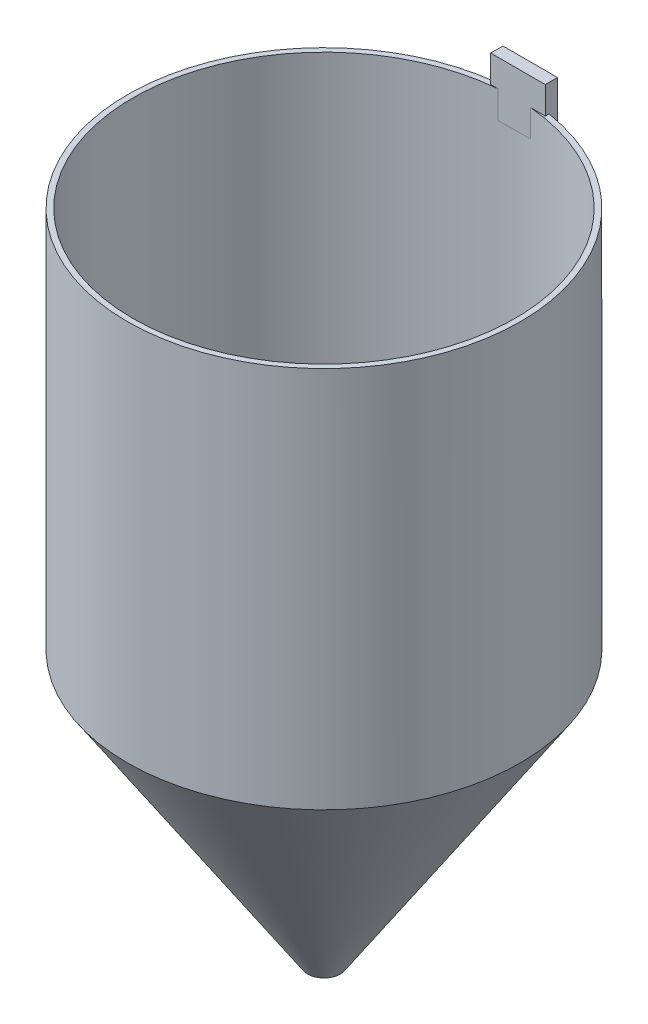
from build123d import *

# Parameters (mm, degrees)
SKETCH2_R           = 2
SKETCH2_R_2         = 5
CUT_EXTRUDE1_DEPTH  = 3
SKETCH3_W           = 10
SKETCH3_H           = 2.237585103
BOSS_EXTRUDE1_DEPTH = 5


with BuildPart() as part:
    # Sketch1 → Revolve1 (revolve)
    with BuildSketch(Plane.XY, mode=Mode.PRIVATE) as revolve1_sk:
        Polygon((2.310834394, 103.017979097), (2.310834394, 34.01998915), (-32.689165606, 34.01998915), (-32.689165606, 33.01998915), (2.310836414, 33.01998915), (-29.686396209, -16.982020903), (3.310834394, 33.017979097), (3.310834394, 103.017979097), align=None)
    revolve(revolve1_sk.sketch.rotate(Axis((-32.689165606, 34.01998915, 0), (0, -1, 0)), 90), axis=Axis((-32.689165606, 34.01998915, 0), (0, -1, 0)))

    # Sketch2 → Cut-Extrude1 (cut)
    with BuildSketch(Plane(origin=(0, 34.01998915, 0), x_dir=(1, 0, 0), z_dir=(0, 1, 0))):
        with Locations(Location((-32.689165606, 0, 0), (0, 0, 270))):
            Circle(SKETCH2_R)
        with Locations(Location((-14.583845408, 17.239413579, 0), (0, 0, 270))):
            Circle(SKETCH2_R_2)
    extrude(amount=-CUT_EXTRUDE1_DEPTH, mode=Mode.SUBTRACT)

    # Sketch3 → Boss-Extrude1 (add, symmetric)
    with BuildSketch(Plane(origin=(0, 103.017979097, 0), x_dir=(1, 0, 0), z_dir=(0, 1, 0))):
        with Locations((-32.016176603, 35.993708975)):
            Rectangle(SKETCH3_W, SKETCH3_H)
    extrude(amount=BOSS_EXTRUDE1_DEPTH, both=True)


solid = part.part
